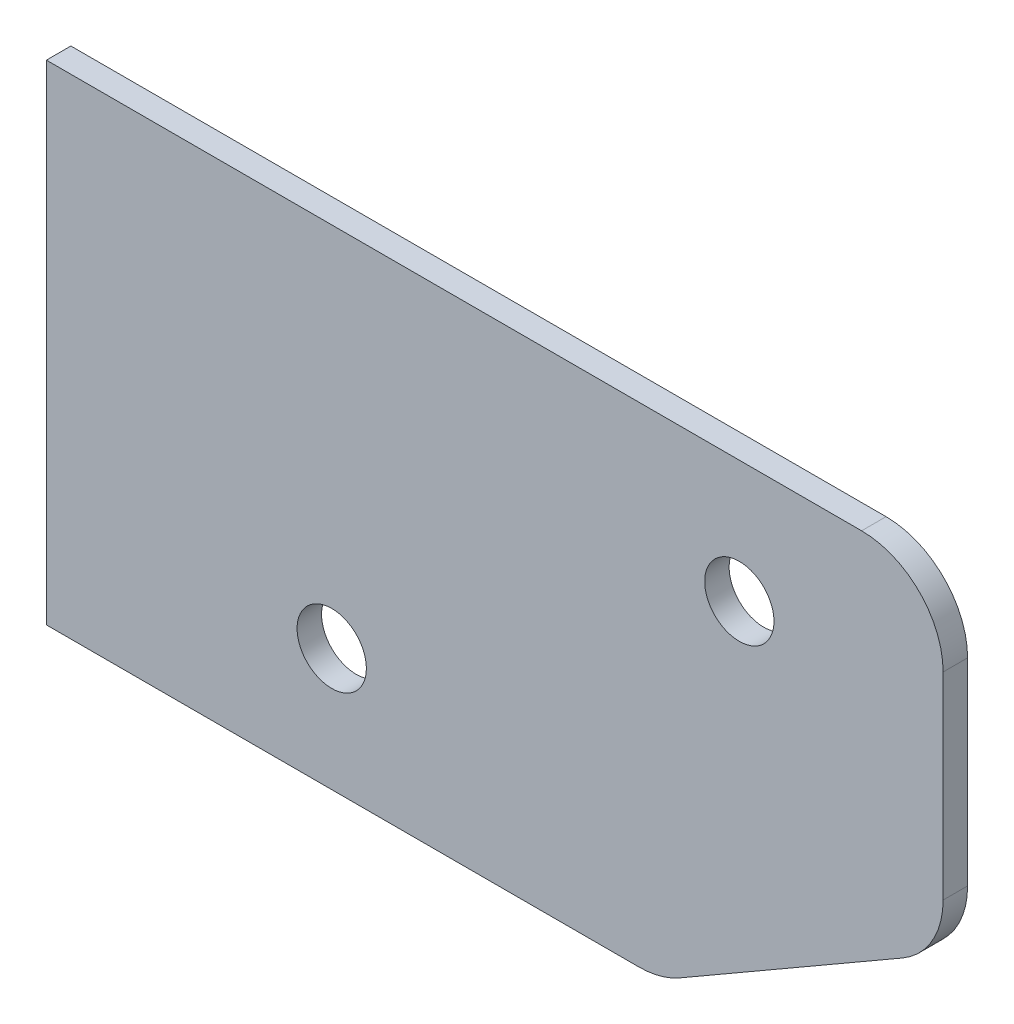
from build123d import *

# Parameters (mm, degrees)
BOSS_EXTRUDE1_DEPTH = 3
FILLET1_R           = 10
SKETCH2_R           = 4.25
CUT_EXTRUDE1_DEPTH  = 126.335549626


with BuildPart() as part:
    # Sketch1 → Boss-Extrude1 (new body)
    with BuildSketch(Plane.XY):
        Polygon((0, 0), (0, 60), (110, 60), (110, 20), (75.358983849, 0), align=None)
    extrude(amount=BOSS_EXTRUDE1_DEPTH)

    # Fillet1
    fillet1_edges = [part.edges().sort_by_distance(p)[0] for p in [
        (110, 60, 1.5),
        (110, 20, 1.5),
        (75.358983849, 0, 1.5),
    ]]
    fillet(fillet1_edges, radius=FILLET1_R)

    # Sketch2 → Cut-Extrude1 (cut, through all)
    with BuildSketch(Plane.XY.offset(3)):
        with Locations((35, 15)):
            Circle(SKETCH2_R)
        with Locations((85, 45)):
            Circle(SKETCH2_R)
    extrude(amount=-CUT_EXTRUDE1_DEPTH, mode=Mode.SUBTRACT)


solid = part.part
